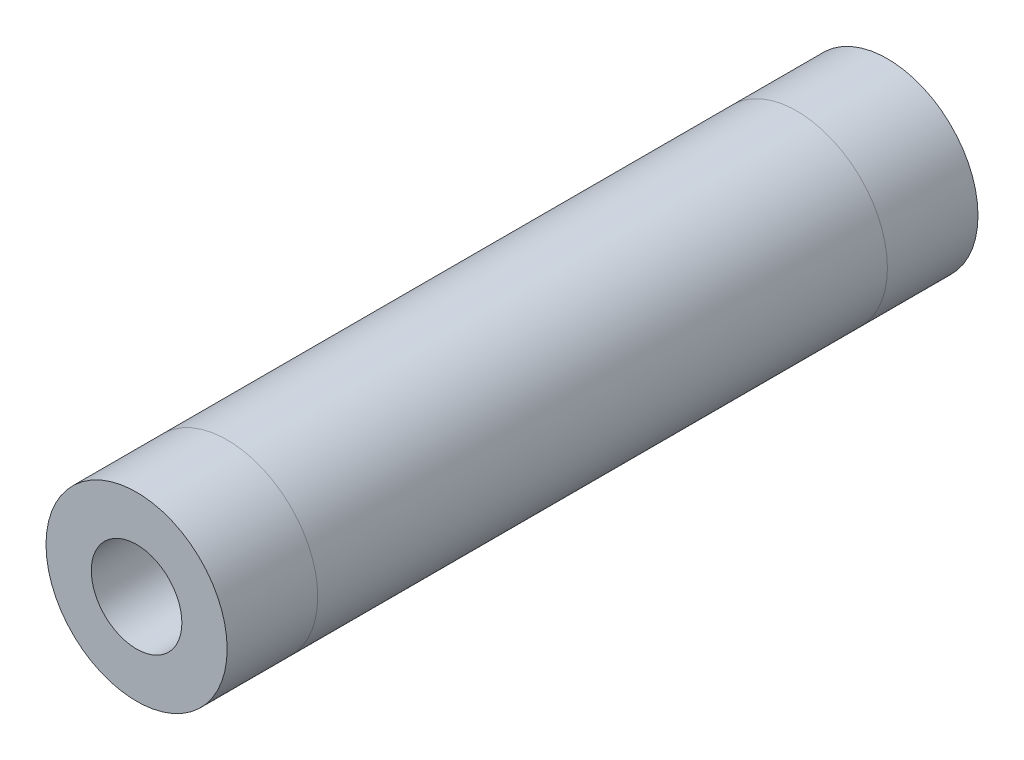
from build123d import *

# Parameters (mm, degrees)
THREADED_START            = -21.9075
SKETCH2_R                 = 6.35
SKETCH2_R_2               = 4.7625
SKETCH2_R_3               = 3.175
THREADED_INSERT_1_1_DEPTH = 6.35
THREADED_START_2          = -28.2575
SKETCH2_5_R               = 4.7625
SKETCH2_5_R_2             = 3.175
THREADED_INSERT_1_2_DEPTH = 6.35
BOSS_EXTRUDE4_START       = -74.545726
SKETCH2_7_R               = 6.35
SKETCH2_7_R_2             = 4.7625
SKETCH2_7_R_3             = 3.175
BOSS_EXTRUDE4_DEPTH       = 6.35
BOSS_EXTRUDE5_START       = -61.845726
SKETCH2_8_R               = 4.7625
SKETCH2_8_R_2             = 3.175
BOSS_EXTRUDE5_DEPTH       = 6.35
BOSS_EXTRUDE6_START       = -28.2575
SKETCH2_9_R               = 6.35
SKETCH2_9_R_2             = 4.7625
BOSS_EXTRUDE6_DEPTH       = 39.938226194


with BuildPart() as part:
    # Sketch2 → Threaded Insert 1-1 (new body)
    # profile 1 of 2: a face of its own
    with BuildSketch(Plane.XY.offset(THREADED_START)):
        Circle(SKETCH2_R)
        Circle(SKETCH2_R_2, mode=Mode.SUBTRACT)
    # profile 2 of 2: a face of its own
    with BuildSketch(Plane.XY.offset(THREADED_START)):
        Circle(SKETCH2_R_2)
        Circle(SKETCH2_R_3, mode=Mode.SUBTRACT)
    extrude(amount=-THREADED_INSERT_1_1_DEPTH)

    # Sketch2<5> → Threaded Insert 1-2 (add)
    with BuildSketch(Plane.XY.offset(THREADED_START_2)):
        Circle(SKETCH2_5_R)
        Circle(SKETCH2_5_R_2, mode=Mode.SUBTRACT)
    extrude(amount=-THREADED_INSERT_1_2_DEPTH)


with BuildPart() as body_2:
    # Sketch2<7> → Boss-Extrude4 (new body)
    # profile 1 of 2: a face of its own
    with BuildSketch(Plane.XY.offset(BOSS_EXTRUDE4_START)):
        Circle(SKETCH2_7_R)
        Circle(SKETCH2_7_R_2, mode=Mode.SUBTRACT)
    # profile 2 of 2: a face of its own
    with BuildSketch(Plane.XY.offset(BOSS_EXTRUDE4_START)):
        Circle(SKETCH2_7_R_2)
        Circle(SKETCH2_7_R_3, mode=Mode.SUBTRACT)
    extrude(amount=BOSS_EXTRUDE4_DEPTH)

    # Sketch2<8> → Boss-Extrude5 (add)
    with BuildSketch(Plane.XY.offset(BOSS_EXTRUDE5_START)):
        Circle(SKETCH2_8_R)
        Circle(SKETCH2_8_R_2, mode=Mode.SUBTRACT)
    extrude(amount=-BOSS_EXTRUDE5_DEPTH)


with BuildPart() as body_3:
    # Sketch2<9> → Boss-Extrude6 (new body)
    with BuildSketch(Plane.XY.offset(BOSS_EXTRUDE6_START)):
        Circle(SKETCH2_9_R)
        Circle(SKETCH2_9_R_2, mode=Mode.SUBTRACT)
    extrude(amount=-BOSS_EXTRUDE6_DEPTH)


solid = Compound([part.part, body_2.part, body_3.part])
